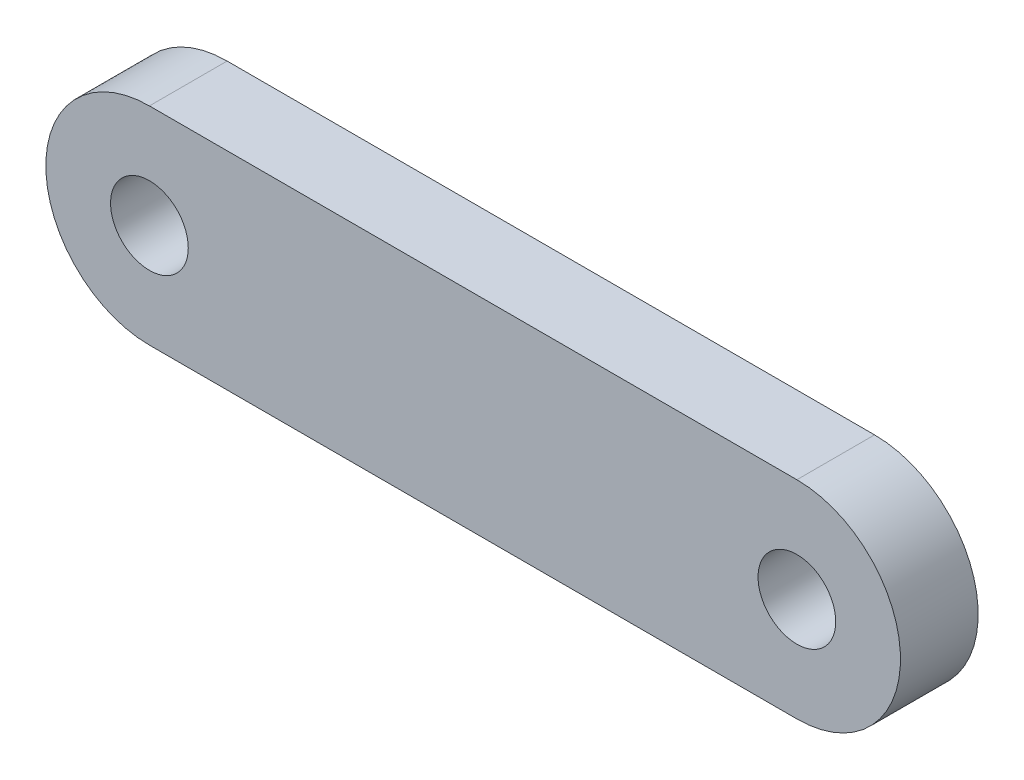
from build123d import *

# Parameters (mm, degrees)
SKETCH1_R           = 1.5
BOSS_EXTRUDE1_DEPTH = 3


with BuildPart() as part:
    # Sketch1 → Boss-Extrude1 (new body)
    with BuildSketch(Plane.XY):
        with BuildLine():
            Line((-25, 4), (0, 4))
            ThreePointArc((0, 4), (4, 0), (0, -4))
            Line((0, -4), (-25, -4))
            ThreePointArc((-25, -4), (-29, 0), (-25, 4))
        make_face()
        Circle(SKETCH1_R, mode=Mode.SUBTRACT)
        with Locations((-25, 0)):
            Circle(SKETCH1_R, mode=Mode.SUBTRACT)
    extrude(amount=BOSS_EXTRUDE1_DEPTH)


solid = part.part
